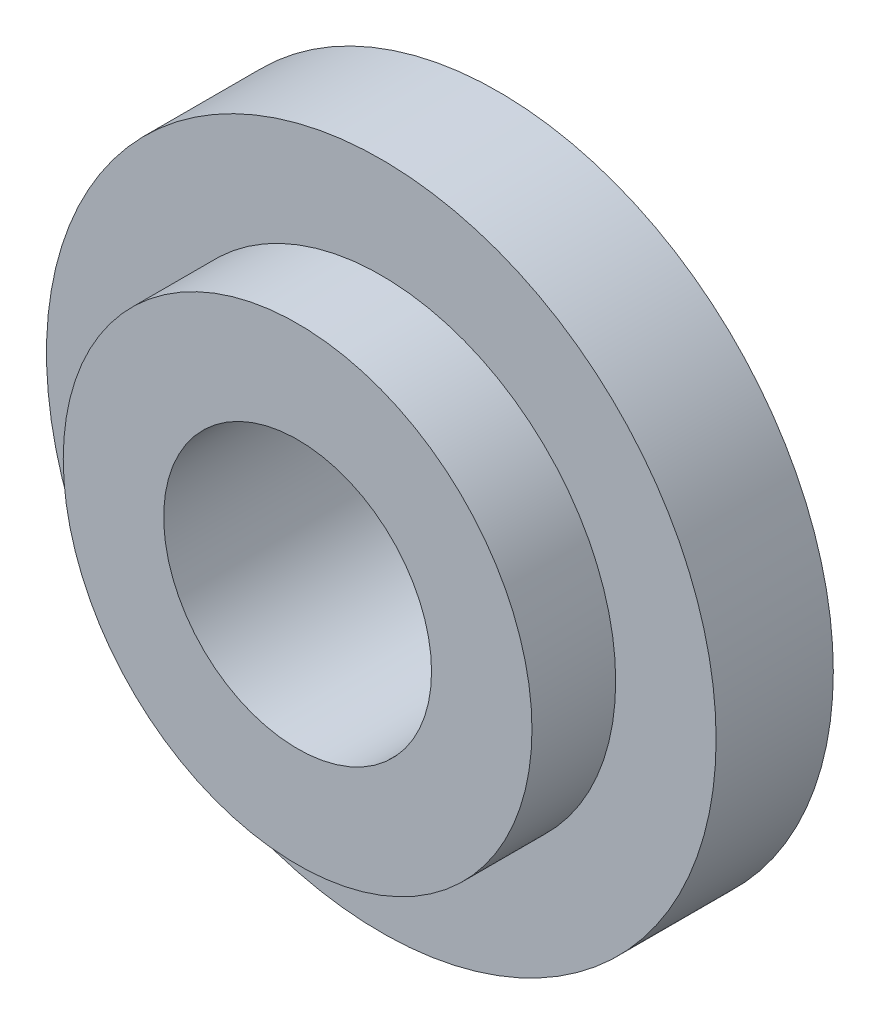
from build123d import *

# Parameters (mm, degrees)
ESQUISSE1_R          = 10
ESQUISSE1_R_2        = 4
BASE_EXTRUSION_DEPTH = 3.5
ESQUISSE2_R          = 7
ESQUISSE2_R_2        = 4
BOSS_EXTRU_1_DEPTH   = 2.5


with BuildPart() as part:
    # Esquisse1 → Base-Extrusion (new body)
    with BuildSketch(Plane.XY):
        Circle(ESQUISSE1_R)
        Circle(ESQUISSE1_R_2, mode=Mode.SUBTRACT)
    extrude(amount=BASE_EXTRUSION_DEPTH)

    # Esquisse2 → Boss.-Extru.1 (add)
    with BuildSketch(Plane.XY.offset(3.5)):
        Circle(ESQUISSE2_R)
        Circle(ESQUISSE2_R_2, mode=Mode.SUBTRACT)
    extrude(amount=BOSS_EXTRU_1_DEPTH)


solid = part.part
